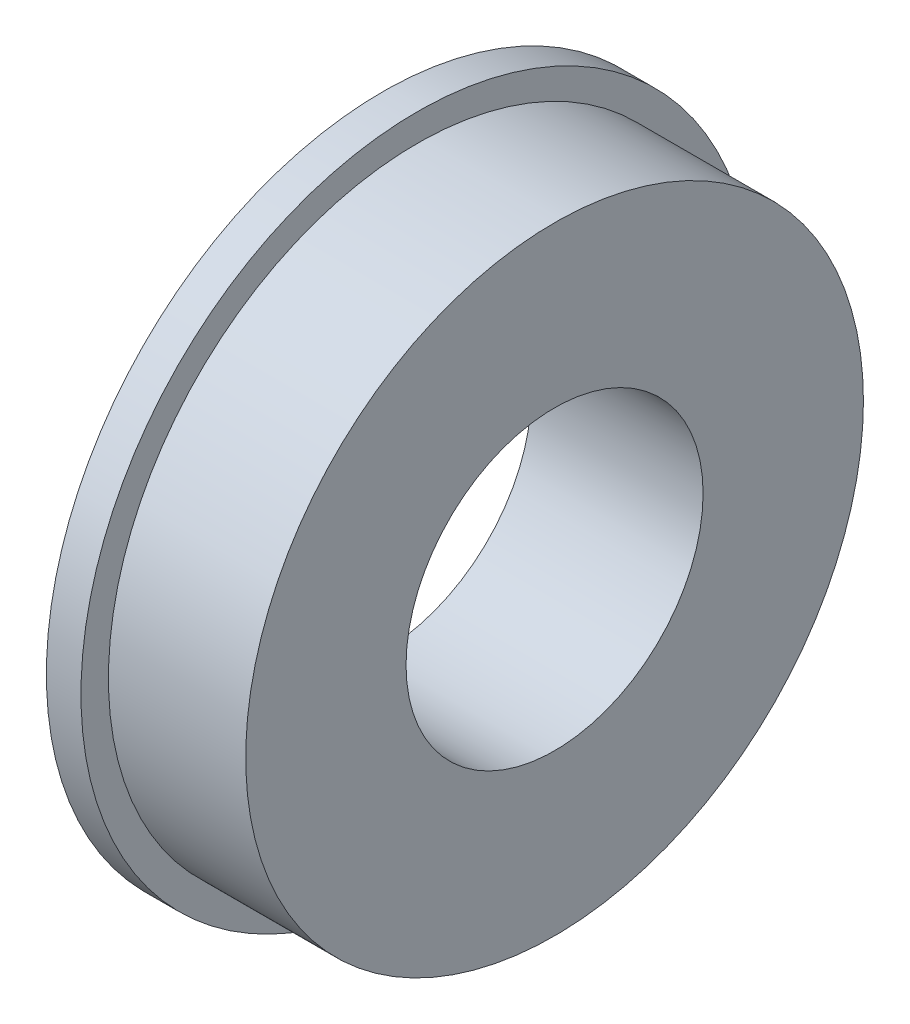
from build123d import *

# Parameters (mm, degrees)
BODY_MOVE_COPY1_ANGLE = 90


with BuildPart() as part:
    # Sketch5 → Revolve1 (revolve)
    with BuildSketch(Plane.XY, mode=Mode.PRIVATE) as revolve1_sk:
        Polygon((6.8707, 7.9502), (6.8707, 0), (14.2875, 0), (14.2875, 6.35), (15.5575, 6.35), (15.5575, 7.9502), (12.6619, 7.9502), (12.6619, 7.3152), (9.7663, 7.3152), (9.7663, 7.9502), align=None)
    revolve(revolve1_sk.sketch.rotate(Axis((0, 0, 0), (0, 1, 0)), 90), axis=Axis((0, 0, 0), (0, 1, 0)))


with BuildPart() as part_1:
    # Body-Move/Copy1: moved
    add(part.part.rotate(Axis((0, 3.9751, 0), (0, 0, 1)), BODY_MOVE_COPY1_ANGLE))


solid = part_1.part
